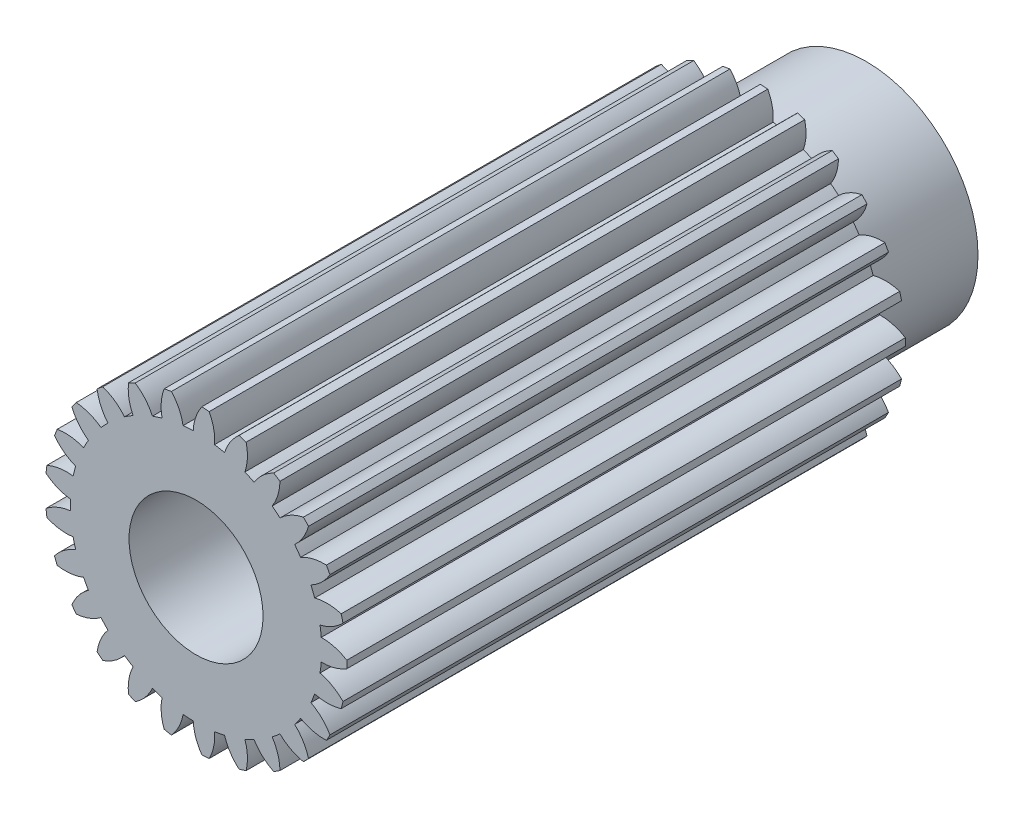
from build123d import *

# Parameters (mm, degrees)
EXTRUDE_1_DEPTH     = 25
SKETCH_2_R          = 5
SKETCH_2_R_2        = 2.75
EXTRUDE_2_DEPTH     = 5
SKETCH_3_R          = 3
EXTRUDE_3_DEPTH     = 1.5
SKETCH_4_R          = 3
CUT_EXTRUDE_1_DEPTH = 23.5
SKETCH_5_R          = 1.6
CUT_EXTRUDE_2_DEPTH = 26.363528361


with BuildPart() as part:
    # 草图1 → 凸台-拉伸1 (new body)
    with BuildSketch(Plane.XY):
        with BuildLine():
            ThreePointArc((-0.126349393, 5.623580784), (-0.353196672, 5.613900347), (-0.579468474, 5.595072947))
            ThreePointArc((-0.579468474, 5.595072947), (-0.765010507, 6.164212032), (-1.101088476, 6.659587387))
            ThreePointArc((-1.101088476, 6.659587387), (-1.264823873, 6.630438942), (-1.427791454, 6.597265461))
            ThreePointArc((-1.427791454, 6.597265461), (-1.557909016, 6.012958552), (-1.520907565, 5.415483836))
            ThreePointArc((-1.520907565, 5.415483836), (-1.738220593, 5.349692904), (-1.952701466, 5.275185493))
            ThreePointArc((-1.952701466, 5.275185493), (-2.27395349, 5.7803016), (-2.722667793, 6.176534634))
            ThreePointArc((-2.722667793, 6.176534634), (-2.874010218, 6.107582604), (-3.023607963, 6.03492294))
            ThreePointArc((-3.023607963, 6.03492294), (-3.004326424, 5.436614185), (-2.819901521, 4.867112122))
            ThreePointArc((-2.819901521, 4.867112122), (-3.014025722, 4.749344581), (-3.203239044, 4.623838733))
            ThreePointArc((-3.203239044, 4.623838733), (-3.640015612, 5.033193559), (-4.173171879, 5.305387495))
            ThreePointArc((-4.173171879, 5.305387495), (-4.302611931, 5.200964389), (-4.429440063, 5.093384015))
            ThreePointArc((-4.429440063, 5.093384015), (-4.261970953, 4.518667354), (-3.941710694, 4.012921854))
            ThreePointArc((-3.941710694, 4.012921854), (-4.100448529, 3.850577471), (-4.252505332, 3.68195918))
            ThreePointArc((-4.252505332, 3.68195918), (-4.777362166, 3.969831456), (-5.361460228, 4.100883347))
            ThreePointArc((-5.361460228, 4.100883347), (-5.460864712, 3.967550453), (-5.556954155, 3.831809041))
            ThreePointArc((-5.556954155, 3.831809041), (-5.251820172, 3.316796034), (-4.815847687, 2.906584947))
            ThreePointArc((-4.815847687, 2.906584947), (-4.929225075, 2.709864417), (-5.03457107, 2.508728591))
            ThreePointArc((-5.03457107, 2.508728591), (-5.614529486, 2.657030243), (-6.212868313, 2.638705616))
            ThreePointArc((-6.212868313, 2.638705616), (-6.27599128, 2.484840731), (-6.335304379, 2.329467412))
            ThreePointArc((-6.335304379, 2.329467412), (-5.911678216, 1.906518221), (-5.387387259, 1.617616618))
            ThreePointArc((-5.387387259, 1.617616618), (-5.448280281, 1.398880615), (-5.500296192, 1.177865357))
            ThreePointArc((-5.500296192, 1.177865357), (-6.098915269, 1.177278047), (-6.673899032, 1.010728308))
            ThreePointArc((-6.673899032, 1.010728308), (-6.696774234, 0.845999327), (-6.71558413, 0.680756778))
            ThreePointArc((-6.71558413, 0.680756778), (-6.200083775, 0.376446857), (-5.620417476, 0.227007488))
            ThreePointArc((-5.620417476, 0.227007488), (-5.625, 0), (-5.620417476, -0.227007488))
            ThreePointArc((-5.620417476, -0.227007488), (-6.200083775, -0.376446857), (-6.71558413, -0.680756778))
            ThreePointArc((-6.71558413, -0.680756778), (-6.696774234, -0.845999327), (-6.673899032, -1.010728308))
            ThreePointArc((-6.673899032, -1.010728308), (-6.098915269, -1.177278047), (-5.500296192, -1.177865357))
            ThreePointArc((-5.500296192, -1.177865357), (-5.448280281, -1.398880615), (-5.387387259, -1.617616618))
            ThreePointArc((-5.387387259, -1.617616618), (-5.911678216, -1.906518221), (-6.335304379, -2.329467412))
            ThreePointArc((-6.335304379, -2.329467412), (-6.27599128, -2.484840731), (-6.212868313, -2.638705616))
            ThreePointArc((-6.212868313, -2.638705616), (-5.614529486, -2.657030243), (-5.03457107, -2.508728591))
            ThreePointArc((-5.03457107, -2.508728591), (-4.929225075, -2.709864417), (-4.815847687, -2.906584947))
            ThreePointArc((-4.815847687, -2.906584947), (-5.251820172, -3.316796034), (-5.556954155, -3.831809041))
            ThreePointArc((-5.556954155, -3.831809041), (-5.460864712, -3.967550453), (-5.361460228, -4.100883347))
            ThreePointArc((-5.361460228, -4.100883347), (-4.777362166, -3.969831456), (-4.252505332, -3.68195918))
            ThreePointArc((-4.252505332, -3.68195918), (-4.100448529, -3.850577471), (-3.941710694, -4.012921854))
            ThreePointArc((-3.941710694, -4.012921854), (-4.261970953, -4.518667354), (-4.429440063, -5.093384015))
            ThreePointArc((-4.429440063, -5.093384015), (-4.302611931, -5.200964389), (-4.173171879, -5.305387495))
            ThreePointArc((-4.173171879, -5.305387495), (-3.640015612, -5.033193559), (-3.203239044, -4.623838733))
            ThreePointArc((-3.203239044, -4.623838733), (-3.014025722, -4.749344581), (-2.819901521, -4.867112122))
            ThreePointArc((-2.819901521, -4.867112122), (-3.004326424, -5.436614185), (-3.023607963, -6.03492294))
            ThreePointArc((-3.023607963, -6.03492294), (-2.874010218, -6.107582604), (-2.722667793, -6.176534634))
            ThreePointArc((-2.722667793, -6.176534634), (-2.27395349, -5.7803016), (-1.952701466, -5.275185493))
            ThreePointArc((-1.952701466, -5.275185493), (-1.738220593, -5.349692904), (-1.520907565, -5.415483836))
            ThreePointArc((-1.520907565, -5.415483836), (-1.557909016, -6.012958552), (-1.427791454, -6.597265461))
            ThreePointArc((-1.427791454, -6.597265461), (-1.264823873, -6.630438942), (-1.101088476, -6.659587387))
            ThreePointArc((-1.101088476, -6.659587387), (-0.765010507, -6.164212032), (-0.579468474, -5.595072947))
            ThreePointArc((-0.579468474, -5.595072947), (-0.353196672, -5.613900347), (-0.126349393, -5.623580784))
            ThreePointArc((-0.126349393, -5.623580784), (-0.013602456, -6.21148662), (0.257738444, -6.745077531))
            ThreePointArc((0.257738444, -6.745077531), (0.423836007, -6.736680417), (0.589676279, -6.724193772))
            ThreePointArc((0.589676279, -6.724193772), (0.7920009, -6.160802353), (0.830174654, -5.563401392))
            ThreePointArc((0.830174654, -5.563401392), (1.054019895, -5.525365785), (1.276147777, -5.478327469))
            ThreePointArc((1.276147777, -5.478327469), (1.531558797, -6.019724139), (1.927073686, -6.469071572))
            ThreePointArc((1.927073686, -6.469071572), (2.085864712, -6.419631485), (2.243389504, -6.366294333))
            ThreePointArc((2.243389504, -6.366294333), (2.299247977, -5.770286804), (2.187654855, -5.182160866))
            ThreePointArc((2.187654855, -5.182160866), (2.395008515, -5.08965217), (2.598459887, -4.988850691))
            ThreePointArc((2.598459887, -4.988850691), (2.980486578, -5.449720251), (3.475323802, -5.786590055))
            ThreePointArc((3.475323802, -5.786590055), (3.616830866, -5.699213497), (3.756142317, -5.608377207))
            ThreePointArc((3.756142317, -5.608377207), (3.662024848, -5.017202913), (3.407676656, -4.475306114))
            ThreePointArc((3.407676656, -4.475306114), (3.585509942, -4.334136991), (3.757501207, -4.185906076))
            ThreePointArc((3.757501207, -4.185906076), (4.242139425, -4.537290397), (4.805206542, -4.740515804))
            ThreePointArc((4.805206542, -4.740515804), (4.920538235, -4.620692965), (5.032882894, -4.498065115))
            ThreePointArc((5.032882894, -4.498065115), (4.79470323, -3.948869711), (4.4135816, -3.48725142))
            ThreePointArc((4.4135816, -3.48725142), (4.550720593, -3.306292044), (4.680444907, -3.119945588))
            ThreePointArc((4.680444907, -3.119945588), (5.237243052, -3.339765901), (5.833160483, -3.39657751))
            ThreePointArc((5.833160483, -3.39657751), (5.91507009, -3.2518373), (5.993388929, -3.105123049))
            ThreePointArc((5.993388929, -3.105123049), (5.626112774, -2.632414502), (5.14216498, -2.280079894))
            ThreePointArc((5.14216498, -2.280079894), (5.229992733, -2.070700609), (5.30929904, -1.857947445))
            ThreePointArc((5.30929904, -1.857947445), (5.903271436, -1.93239163), (6.494595498, -1.839219759))
            ThreePointArc((6.494595498, -1.839219759), (6.537936338, -1.678656738), (6.577308295, -1.517074682))
            ThreePointArc((6.577308295, -1.517074682), (6.104012961, -1.150555009), (5.547647223, -0.929642562))
            ThreePointArc((5.547647223, -0.929642562), (5.580645195, -0.704999439), (5.604550388, -0.47920763))
            ThreePointArc((5.604550388, -0.47920763), (6.198375565, -0.403598087), (6.747951192, -0.166297067))
            ThreePointArc((6.747951192, -0.166297067), (6.75, 0), (6.747951192, 0.166297067))
            ThreePointArc((6.747951192, 0.166297067), (6.198375565, 0.403598087), (5.604550388, 0.47920763))
            ThreePointArc((5.604550388, 0.47920763), (5.580645195, 0.704999439), (5.547647223, 0.929642562))
            ThreePointArc((5.547647223, 0.929642562), (6.104012961, 1.150555009), (6.577308295, 1.517074682))
            ThreePointArc((6.577308295, 1.517074682), (6.537936338, 1.678656738), (6.494595498, 1.839219759))
            ThreePointArc((6.494595498, 1.839219759), (5.903271436, 1.93239163), (5.30929904, 1.857947445))
            ThreePointArc((5.30929904, 1.857947445), (5.229992733, 2.070700609), (5.14216498, 2.280079894))
            ThreePointArc((5.14216498, 2.280079894), (5.626112774, 2.632414502), (5.993388929, 3.105123049))
            ThreePointArc((5.993388929, 3.105123049), (5.91507009, 3.2518373), (5.833160483, 3.39657751))
            ThreePointArc((5.833160483, 3.39657751), (5.237243052, 3.339765901), (4.680444907, 3.119945588))
            ThreePointArc((4.680444907, 3.119945588), (4.550720593, 3.306292044), (4.4135816, 3.48725142))
            ThreePointArc((4.4135816, 3.48725142), (4.79470323, 3.948869711), (5.032882894, 4.498065115))
            ThreePointArc((5.032882894, 4.498065115), (4.920538235, 4.620692965), (4.805206542, 4.740515804))
            ThreePointArc((4.805206542, 4.740515804), (4.242139425, 4.537290397), (3.757501207, 4.185906076))
            ThreePointArc((3.757501207, 4.185906076), (3.585509942, 4.334136991), (3.407676656, 4.475306114))
            ThreePointArc((3.407676656, 4.475306114), (3.662024848, 5.017202913), (3.756142317, 5.608377207))
            ThreePointArc((3.756142317, 5.608377207), (3.616830866, 5.699213497), (3.475323802, 5.786590055))
            ThreePointArc((3.475323802, 5.786590055), (2.980486578, 5.449720251), (2.598459887, 4.988850691))
            ThreePointArc((2.598459887, 4.988850691), (2.395008515, 5.08965217), (2.187654855, 5.182160866))
            ThreePointArc((2.187654855, 5.182160866), (2.299247977, 5.770286804), (2.243389504, 6.366294333))
            ThreePointArc((2.243389504, 6.366294333), (2.085864712, 6.419631485), (1.927073686, 6.469071572))
            ThreePointArc((1.927073686, 6.469071572), (1.531558797, 6.019724139), (1.276147777, 5.478327469))
            ThreePointArc((1.276147777, 5.478327469), (1.054019895, 5.525365785), (0.830174654, 5.563401392))
            ThreePointArc((0.830174654, 5.563401392), (0.7920009, 6.160802353), (0.589676279, 6.724193772))
            ThreePointArc((0.589676279, 6.724193772), (0.423836007, 6.736680417), (0.257738444, 6.745077531))
            ThreePointArc((0.257738444, 6.745077531), (-0.013602456, 6.21148662), (-0.126349393, 5.623580784))
        make_face()
    extrude(amount=EXTRUDE_1_DEPTH)

    # 草图2 → 凸台-拉伸2 (add)
    with BuildSketch(Plane(origin=(0, 0, 0), x_dir=(-1, 0, 0), z_dir=(0, 0, -1))):
        with Locations(Location((0, 0, 0), (0, 0, 180))):
            Circle(SKETCH_2_R)
        Circle(SKETCH_2_R_2, mode=Mode.SUBTRACT)
    extrude(amount=EXTRUDE_2_DEPTH)

    # 草图3 → 凸台-拉伸3 (add)
    with BuildSketch(Plane(origin=(0, 0, 0), x_dir=(-1, 0, 0), z_dir=(0, 0, -1))):
        Circle(SKETCH_3_R)
    extrude(amount=EXTRUDE_3_DEPTH)

    # 草图4 → 切除-拉伸1 (cut)
    with BuildSketch(Plane.XY.offset(25)):
        Circle(SKETCH_4_R)
    extrude(amount=-CUT_EXTRUDE_1_DEPTH, mode=Mode.SUBTRACT)

    # 草图5 → 切除-拉伸2 (cut, through all)
    with BuildSketch(Plane.XY.offset(1.5)):
        Circle(SKETCH_5_R)
    extrude(amount=-CUT_EXTRUDE_2_DEPTH, mode=Mode.SUBTRACT)


solid = part.part
